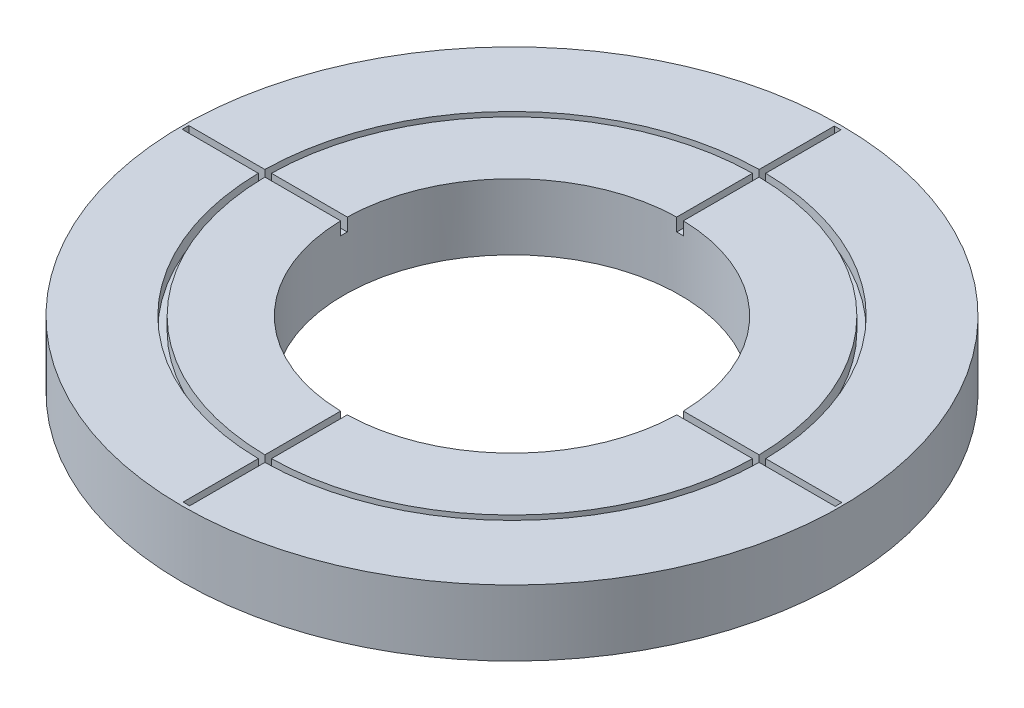
from build123d import *

# Parameters (mm, degrees)
SKETCH1_R           = 12.7
BOSS_EXTRUDE1_DEPTH = 2.54
SKETCH2_R           = 6.477
SKETCH2_R_2         = 6.223
CUT_EXTRUDE1_DEPTH  = 0.5
SKETCH3_R           = 3.302
SKETCH3_R_2         = 3.048
CUT_EXTRUDE2_DEPTH  = 0.5
SKETCH4_R           = 0.25
CUT_EXTRUDE3_DEPTH  = 0.5
SKETCH5_R           = 9.652
SKETCH5_R_2         = 9.398
CUT_EXTRUDE4_DEPTH  = 0.5
SKETCH6_W           = 25.165512812
SKETCH6_H           = 0.254
CUT_EXTRUDE5_DEPTH  = 0.5
SKETCH7_W           = 0.254
SKETCH7_H           = 25.09846579
CUT_EXTRUDE6_DEPTH  = 0.5
SKETCH8_R           = 6.477
CUT_EXTRUDE7_DEPTH  = 10


with BuildPart() as part:
    # Sketch1 → Boss-Extrude1 (new body)
    with BuildSketch(Plane(origin=(0, 0, 0), x_dir=(1, 0, 0), z_dir=(0, 1, 0))):
        with Locations(Location((0, 0, 0), (0, 0, 270))):
            Circle(SKETCH1_R)
    extrude(amount=BOSS_EXTRUDE1_DEPTH)

    # Sketch2 → Cut-Extrude1 (cut)
    with BuildSketch(Plane(origin=(0, 2.54, 0), x_dir=(1, 0, 0), z_dir=(0, 1, 0))):
        with Locations(Location((0, 0, 0), (0, 0, 270))):
            Circle(SKETCH2_R)
        with Locations(Location((0, 0, 0), (0, 0, 270))):
            Circle(SKETCH2_R_2, mode=Mode.SUBTRACT)
    extrude(amount=-CUT_EXTRUDE1_DEPTH, mode=Mode.SUBTRACT)

    # Sketch3 → Cut-Extrude2 (cut)
    with BuildSketch(Plane(origin=(0, 2.54, 0), x_dir=(1, 0, 0), z_dir=(0, 1, 0))):
        with Locations(Location((0, 0, 0), (0, 0, 270))):
            Circle(SKETCH3_R)
        with Locations(Location((0, 0, 0), (0, 0, 270))):
            Circle(SKETCH3_R_2, mode=Mode.SUBTRACT)
    extrude(amount=-CUT_EXTRUDE2_DEPTH, mode=Mode.SUBTRACT)

    # Sketch4 → Cut-Extrude3 (cut)
    with BuildSketch(Plane(origin=(0, 2.54, 0), x_dir=(1, 0, 0), z_dir=(0, 1, 0))):
        with Locations(Location((0, 0, 0), (0, 0, 270))):
            Circle(SKETCH4_R)
    extrude(amount=-CUT_EXTRUDE3_DEPTH, mode=Mode.SUBTRACT)

    # Sketch5 → Cut-Extrude4 (cut)
    with BuildSketch(Plane(origin=(0, 2.54, 0), x_dir=(1, 0, 0), z_dir=(0, 1, 0))):
        with Locations(Location((0, 0, 0), (0, 0, 270))):
            Circle(SKETCH5_R)
        with Locations(Location((0, 0, 0), (0, 0, 270))):
            Circle(SKETCH5_R_2, mode=Mode.SUBTRACT)
    extrude(amount=-CUT_EXTRUDE4_DEPTH, mode=Mode.SUBTRACT)

    # Sketch6 → Cut-Extrude5 (cut)
    with BuildSketch(Plane(origin=(0, 2.54, 0), x_dir=(1, 0, 0), z_dir=(0, 1, 0))):
        Rectangle(SKETCH6_W, SKETCH6_H)
    extrude(amount=-CUT_EXTRUDE5_DEPTH, mode=Mode.SUBTRACT)

    # Sketch7 → Cut-Extrude6 (cut)
    with BuildSketch(Plane(origin=(0, 2.54, 0), x_dir=(1, 0, 0), z_dir=(0, 1, 0))):
        Rectangle(SKETCH7_W, SKETCH7_H)
    extrude(amount=-CUT_EXTRUDE6_DEPTH, mode=Mode.SUBTRACT)

    # Sketch8 → Cut-Extrude7 (cut)
    with BuildSketch(Plane(origin=(0, 2.54, 0), x_dir=(1, 0, 0), z_dir=(0, 1, 0))):
        with Locations(Location((0, 0, 0), (0, 0, 270))):
            Circle(SKETCH8_R)
    extrude(amount=-CUT_EXTRUDE7_DEPTH, mode=Mode.SUBTRACT)


solid = part.part
